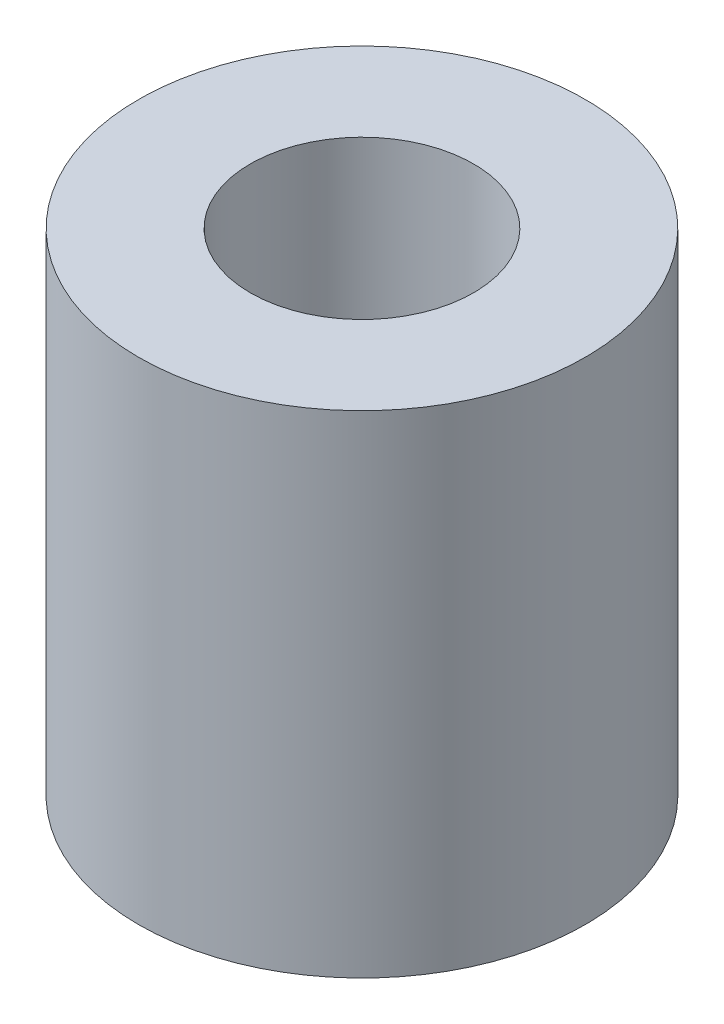
from build123d import *

# Parameters (mm, degrees)
SKETCH1_R           = 5
SKETCH1_R_2         = 2.5
BOSS_EXTRUDE1_DEPTH = 11


with BuildPart() as part:
    # Sketch1 → Boss-Extrude1 (new body)
    with BuildSketch(Plane(origin=(0, 0, 0), x_dir=(1, 0, 0), z_dir=(0, 1, 0))):
        with Locations(Location((0, 0, 0), (0, 0, 270))):
            Circle(SKETCH1_R)
        with Locations(Location((0, 0, 0), (0, 0, 270))):
            Circle(SKETCH1_R_2, mode=Mode.SUBTRACT)
    extrude(amount=BOSS_EXTRUDE1_DEPTH)


solid = part.part
